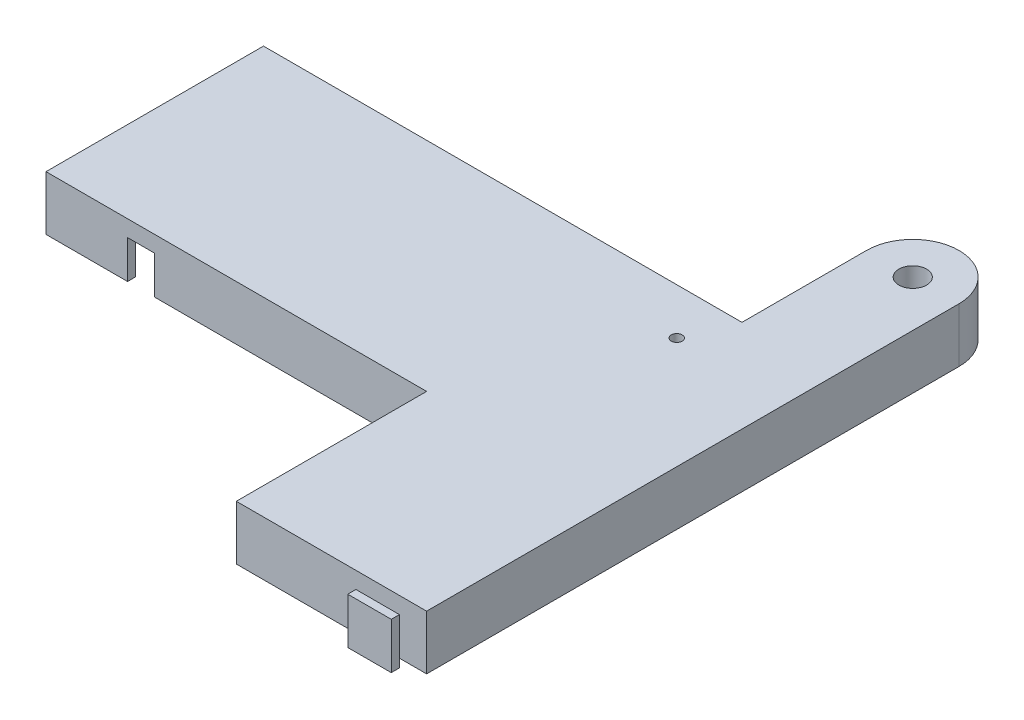
from build123d import *

# Parameters (mm, degrees)
CORNERBOSS_EXTRUDE1_DEPTH               = 20
SHELL1_T                                = -3
PADSKETCH2_R                            = 12
PADSKETCH2_R_2                          = 5
PADBOSS_EXTRUDE2_DEPTH                  = 10
STEPPERRODHOLESKETCH3_R                 = 5.1
STEPPERRODHOLESKETCH3_R_2               = 2
STEPPERRODHOLECUT_EXTRUDE1_DEPTH        = 255.298998474
THREADEDNUTMOUNTHOLESSKETCH4_R          = 2
THREADEDNUTMOUNTHOLESCUT_EXTRUDE2_DEPTH = 10
TLPEGHOLESKETCH1_W                      = 10
TLPEGHOLESKETCH1_H                      = 14
TLPEGHOLECUT_EXTRUDE1_DEPTH             = 3
BOTTOMPEGSKETCH2_W                      = 9.8
BOTTOMPEGSKETCH2_H                      = 13.9
BOTTOMPEGBOSS_EXTRUDE1_DEPTH            = 3.1
BOTTOMPEGCAPSKETCH3_W                   = 16
BOTTOMPEGCAPSKETCH3_H                   = 17
BOTTOMPEGCAPBOSS_EXTRUDE2_DEPTH         = 3
BEDCENTERHOLECUTSKETCH1_W               = 10
BEDCENTERHOLECUTSKETCH1_H               = 14
BEDCENTERHOLECUT_EXTRUDE1_DEPTH         = 3


with BuildPart() as part:
    # CornerSketch1 → CornerBoss-Extrude1 (new body)
    with BuildSketch(Plane(origin=(0, 0, 0), x_dir=(1, 0, 0), z_dir=(0, 1, 0))):
        with BuildLine():
            Line((210, -70), (140, -70))
            Line((140, -70), (140, 0))
            Line((140, 0), (0, 0))
            Line((0, 0), (0, 80))
            Line((0, 80), (176, 80))
            Line((176, 80), (176, 125.825))
            ThreePointArc((176, 125.825), (193, 142.825), (210, 125.825))
            Line((210, 125.825), (210, -70))
        make_face()
    extrude(amount=CORNERBOSS_EXTRUDE1_DEPTH)

    # Shell1
    shell1_openings = [part.faces().sort_by_distance(p)[0] for p in [
        (126.932214483, 0, -30.416556174),
    ]]
    offset(amount=SHELL1_T, openings=shell1_openings, kind=Kind.INTERSECTION)

    # PadSketch2 → PadBoss-Extrude2 (add)
    with BuildSketch(Plane.XZ.offset(-17)):
        with Locations(Location((193, -125.825, 0), (0, 0, 90))):
            Circle(PADSKETCH2_R)
        with Locations(Location((169, -63, 0), (0, 0, 90))):
            Circle(PADSKETCH2_R_2)
    extrude(amount=PADBOSS_EXTRUDE2_DEPTH)

    # StepperRodHoleSketch3 → StepperRodHoleCut-Extrude1 (cut, through all)
    with BuildSketch(Plane.XZ.offset(-7)):
        with Locations(Location((193, -125.825, 0), (0, 0, 270))):
            Circle(STEPPERRODHOLESKETCH3_R)
        with Locations(Location((169, -63, 0), (0, 0, 270))):
            Circle(STEPPERRODHOLESKETCH3_R_2)
    extrude(amount=-STEPPERRODHOLECUT_EXTRUDE1_DEPTH, mode=Mode.SUBTRACT)

    # ThreadedNutMountHolesSketch4 → ThreadedNutMountHolesCut-Extrude2 (cut)
    with BuildSketch(Plane(origin=(0, 7, 0), x_dir=(-1, 0, 0), z_dir=(0, -1, 0))):
        with Locations(Location((-193, 133.825, 0), (0, 0, 90))):
            Circle(THREADEDNUTMOUNTHOLESSKETCH4_R)
        with Locations(Location((-185, 125.825, 0), (0, 0, 90))):
            Circle(THREADEDNUTMOUNTHOLESSKETCH4_R)
        with Locations(Location((-201, 125.825, 0), (0, 0, 90))):
            Circle(THREADEDNUTMOUNTHOLESSKETCH4_R)
        with Locations(Location((-193, 117.825, 0), (0, 0, 90))):
            Circle(THREADEDNUTMOUNTHOLESSKETCH4_R)
    extrude(amount=-THREADEDNUTMOUNTHOLESCUT_EXTRUDE2_DEPTH, mode=Mode.SUBTRACT)

    # TLPegHoleSketch1 → TLPegHoleCut-Extrude1 (cut)
    with BuildSketch(Plane.ZY):
        with Locations((-65, 7)):
            Rectangle(TLPEGHOLESKETCH1_W, TLPEGHOLESKETCH1_H)
    extrude(amount=-TLPEGHOLECUT_EXTRUDE1_DEPTH, mode=Mode.SUBTRACT)

    # BottomPegSketch2 → BottomPegBoss-Extrude1 (add)
    with BuildSketch(Plane.XY.offset(70)):
        with Locations((195, 6.95)):
            Rectangle(BOTTOMPEGSKETCH2_W, BOTTOMPEGSKETCH2_H)
    extrude(amount=BOTTOMPEGBOSS_EXTRUDE1_DEPTH)

    # BottomPegCapSketch3 → BottomPegCapBoss-Extrude2 (add)
    with BuildSketch(Plane.XY.offset(73.1)):
        with Locations((195.1, 8.5)):
            Rectangle(BOTTOMPEGCAPSKETCH3_W, BOTTOMPEGCAPSKETCH3_H)
    extrude(amount=BOTTOMPEGCAPBOSS_EXTRUDE2_DEPTH)

    # BedCenterHoleCutSketch1 → BedCenterHoleCut-Extrude1 (cut)
    with BuildSketch(Plane.XY):
        with Locations((35, 7)):
            Rectangle(BEDCENTERHOLECUTSKETCH1_W, BEDCENTERHOLECUTSKETCH1_H)
    extrude(amount=-BEDCENTERHOLECUT_EXTRUDE1_DEPTH, mode=Mode.SUBTRACT)


solid = part.part
